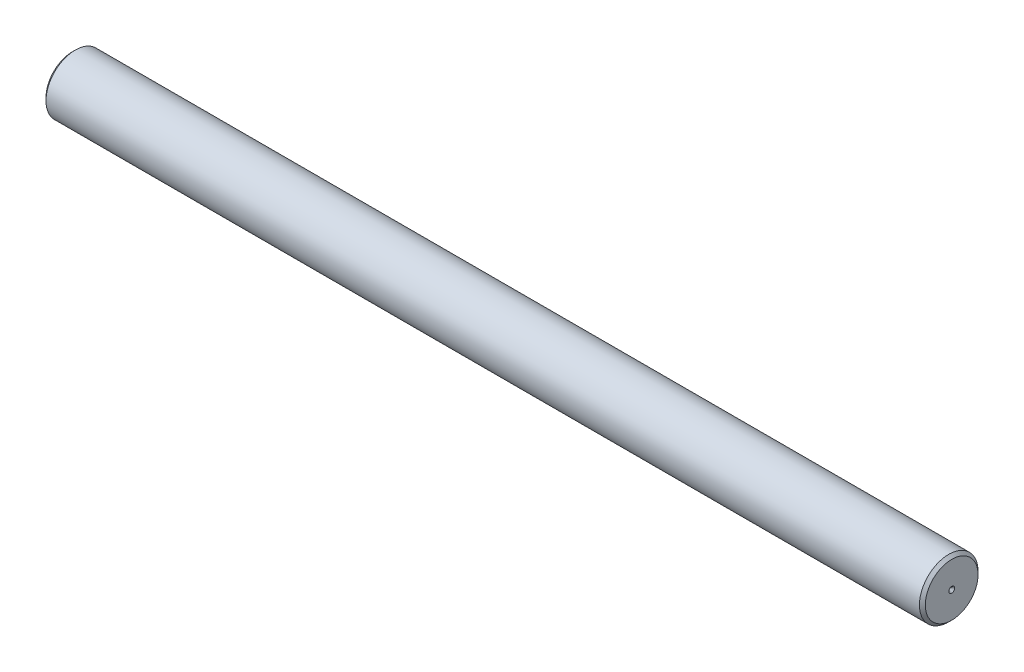
from build123d import *

# Parameters (mm, degrees)
SKETCH1_W     = 150
SKETCH1_H     = 5
CHAMFER1_SIZE = 0.5


with BuildPart() as part:
    # Sketch1 → Revolve1 (revolve)
    with BuildSketch(Plane.XY, mode=Mode.PRIVATE) as revolve1_sk:
        with Locations((75, 2.5)):
            Rectangle(SKETCH1_W, SKETCH1_H)
    revolve(revolve1_sk.sketch.rotate(Axis((0, 0, 0), (1, 0, 0)), 90), axis=Axis((0, 0, 0), (1, 0, 0)))

    # Sketch2 → Cut-Revolve1 (revolve, cut)
    with BuildSketch(Plane.XY, mode=Mode.PRIVATE) as cut_revolve1_sk:
        Polygon((0, 0.5), (0, 0), (0.5, 0), align=None)
        Polygon((149.5, 0), (150, 0.5), (150, 0), align=None)
    revolve(cut_revolve1_sk.sketch.rotate(Axis((0, 0, 0), (1, 0, 0)), 90), axis=Axis((0, 0, 0), (1, 0, 0)), mode=Mode.SUBTRACT)

    # Chamfer1
    chamfer1_edges = [part.edges().sort_by_distance(p)[0] for p in [
        (0, 0, -5),
        (150, 0, -5),
    ]]
    chamfer(chamfer1_edges, length=CHAMFER1_SIZE)


solid = part.part
